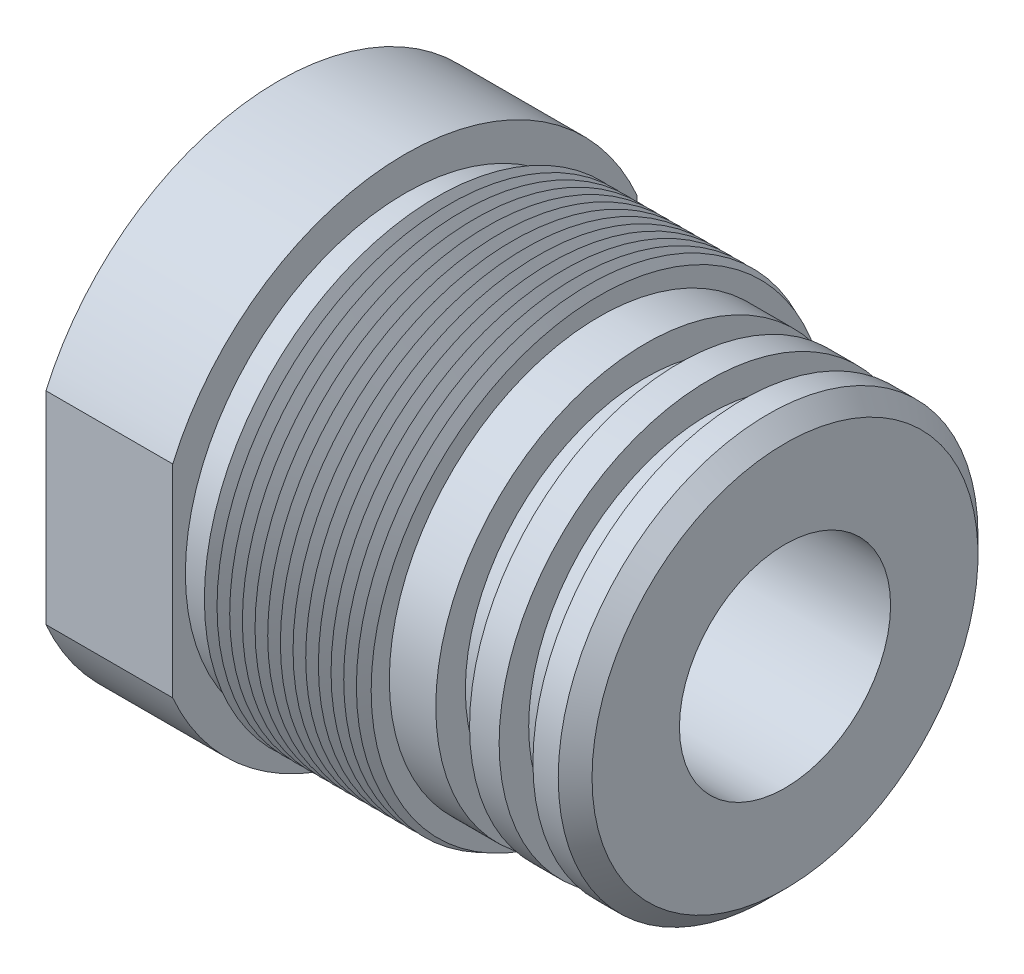
from build123d import *

# Parameters (mm, degrees)
SKETCH2_OUTSIDE_W   = 82.784
SKETCH2_OUTSIDE_H   = 82.784
SKETCH2_OUTSIDE_W_2 = 55
SKETCH2_OUTSIDE_H_2 = 76.69931098
CUT_EXTRUDE1_DEPTH  = 17
SKETCH3_W           = 8
SKETCH3_H           = 7.464974998
SKETCH4_R           = 12.75
CUT_EXTRUDE2_DEPTH  = 1


with BuildPart() as part:
    # Sketch1 → Revolve1 (revolve)
    with BuildSketch(Plane.XY, mode=Mode.PRIVATE) as revolve1_sk:
        Polygon((0, 12.5), (60, 12.5), (60, 22.85), (58, 24.85), (55, 24.85), (55, 21.35), (51, 21.35), (51, 24.85), (47.5, 24.85), (47.5, 21.35), (43.5, 21.35), (43.5, 24.85), (38, 24.85), (38, 27), (37.5, 26), (36.75, 27.5), (36, 26), (35.25, 27.5), (34.5, 26), (33.75, 27.5), (33, 26), (32.25, 27.5), (31.5, 26), (30.75, 27.5), (30, 26), (29.25, 27.5), (28.5, 26), (27.75, 27.5), (27, 26), (26.25, 27.5), (25.5, 26), (24.75, 27.5), (24, 26), (23.25, 27.5), (22.5, 26), (21.75, 27.5), (21, 26), (20.25, 27.5), (19.5, 26), (18.75, 27.5), (18, 26), (15, 26), (15, 30), (0, 30), align=None)
    revolve(revolve1_sk.sketch.rotate(Axis((0, 0, 0), (1, 0, 0)), 90), axis=Axis((0, 0, 0), (1, 0, 0)))

    # Sketch2 outside → Cut-Extrude1 (cut)
    with BuildSketch(Plane.ZY):
        Rectangle(SKETCH2_OUTSIDE_W, SKETCH2_OUTSIDE_H)
        Rectangle(SKETCH2_OUTSIDE_W_2, SKETCH2_OUTSIDE_H_2, mode=Mode.SUBTRACT)
    extrude(amount=-CUT_EXTRUDE1_DEPTH, mode=Mode.SUBTRACT)

    # Sketch3 → Cut-Revolve1 (revolve, cut)
    with BuildSketch(Plane(origin=(0, 0, 0), x_dir=(1, 0, 0), z_dir=(0, 1, 0)), mode=Mode.PRIVATE) as cut_revolve1_sk:
        Polygon((4.128668244, 15), (4.128668244, 11.219915318), (0.128668244, 11.219915318), (0.128668244, 12.5), (0.526906778, 15), align=None)
        with Locations((18.128668244, 14.267512501)):
            Rectangle(SKETCH3_W, SKETCH3_H)
        Polygon((32.128668244, 12.5), (32.128668244, 11.219915318), (42.128668244, 11.219915318), (42.128668244, 12.5), (42.128668244, 14.5), (32.128668244, 14.5), align=None)
    revolve(cut_revolve1_sk.sketch.rotate(Axis((0, 0, 0), (1, 0, 0)), 180), axis=Axis((0, 0, 0), (1, 0, 0)), mode=Mode.SUBTRACT)

    # Sketch4 → Cut-Extrude2 (cut)
    with BuildSketch(Plane.ZY):
        Circle(SKETCH4_R)
    extrude(amount=-CUT_EXTRUDE2_DEPTH, mode=Mode.SUBTRACT)


solid = part.part
